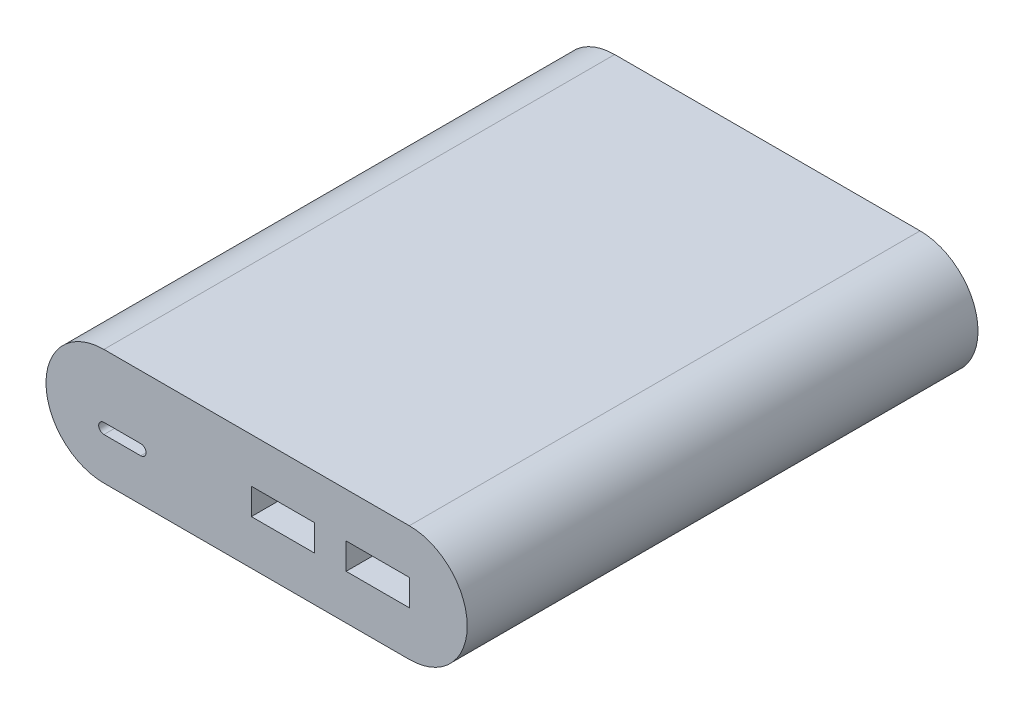
from build123d import *

# Parameters (mm, degrees)
BOSS_EXTRU_1_DEPTH      = 97
ESQUISSE2_W             = 12
ESQUISSE2_H             = 5
ENL_V_MAT_EXTRU_1_DEPTH = 10


with BuildPart() as part:
    # Esquisse1 → Boss.-Extru.1 (new body)
    with BuildSketch(Plane.XY):
        with BuildLine():
            Line((0, 11), (58, 11))
            ThreePointArc((58, 11), (69, 0), (58, -11))
            Line((58, -11), (0, -11))
            ThreePointArc((0, -11), (-11, 0), (0, 11))
        make_face()
    extrude(amount=BOSS_EXTRU_1_DEPTH)

    # Esquisse2 → Enlèv. mat.-Extru.1 (cut)
    with BuildSketch(Plane.XY.offset(97)):
        with BuildLine():
            Line((0, -1), (7, -1))
            ThreePointArc((7, -1), (8, -2), (7, -3))
            Line((7, -3), (0, -3))
            ThreePointArc((0, -3), (-1, -2), (0, -1))
        make_face()
        with Locations((52, 0)):
            Rectangle(ESQUISSE2_W, ESQUISSE2_H)
        with Locations((34, 0)):
            Rectangle(ESQUISSE2_W, ESQUISSE2_H)
    extrude(amount=-ENL_V_MAT_EXTRU_1_DEPTH, mode=Mode.SUBTRACT)


solid = part.part
